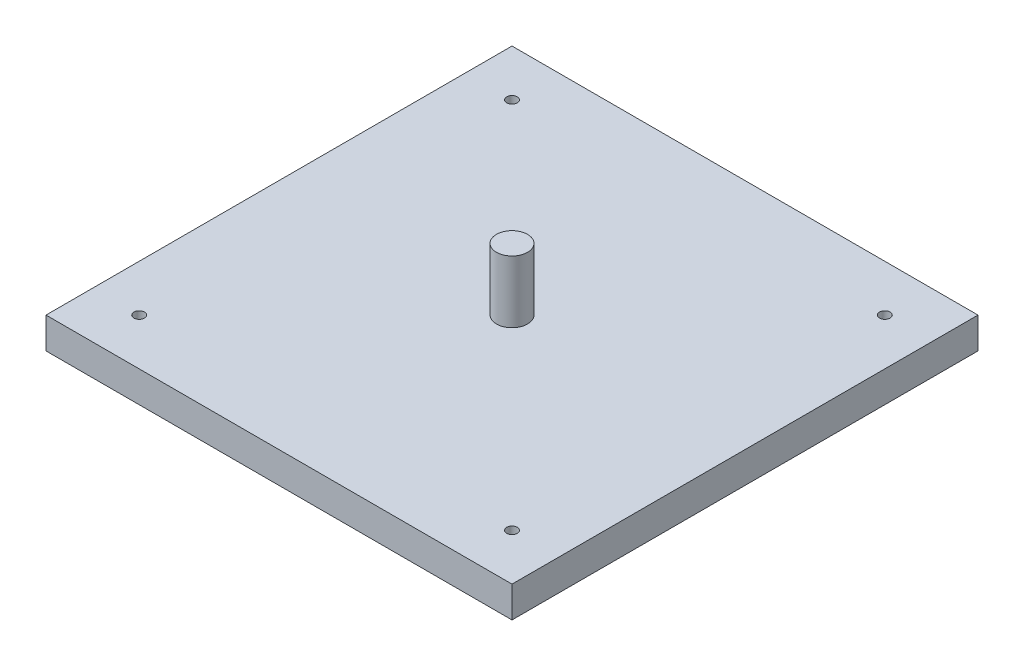
from build123d import *

# Parameters (mm, degrees)
SKETCH2_W           = 150
SKETCH2_H           = 150
SKETCH2_R           = 1.7
SKETCH2_R_2         = 5
BOSS_EXTRUDE1_DEPTH = 10
SKETCH2_3_R         = 5
BOSS_EXTRUDE2_DEPTH = 30


with BuildPart() as part:
    # Sketch2 → Boss-Extrude1 (new body)
    with BuildSketch(Plane(origin=(0, 0, 0), x_dir=(1, 0, 0), z_dir=(0, 1, 0))):
        Rectangle(SKETCH2_W, SKETCH2_H)
        with Locations((-60, -60)):
            Circle(SKETCH2_R, mode=Mode.SUBTRACT)
        with Locations((60, -60)):
            Circle(SKETCH2_R, mode=Mode.SUBTRACT)
        with Locations((-60, 60)):
            Circle(SKETCH2_R, mode=Mode.SUBTRACT)
        Circle(SKETCH2_R_2, mode=Mode.SUBTRACT)
        with Locations((60, 60)):
            Circle(SKETCH2_R, mode=Mode.SUBTRACT)
    extrude(amount=BOSS_EXTRUDE1_DEPTH)

    # Sketch2<3> → Boss-Extrude2 (add)
    with BuildSketch(Plane(origin=(0, 0, 0), x_dir=(1, 0, 0), z_dir=(0, 1, 0))):
        Circle(SKETCH2_3_R)
    extrude(amount=BOSS_EXTRUDE2_DEPTH)


solid = part.part
